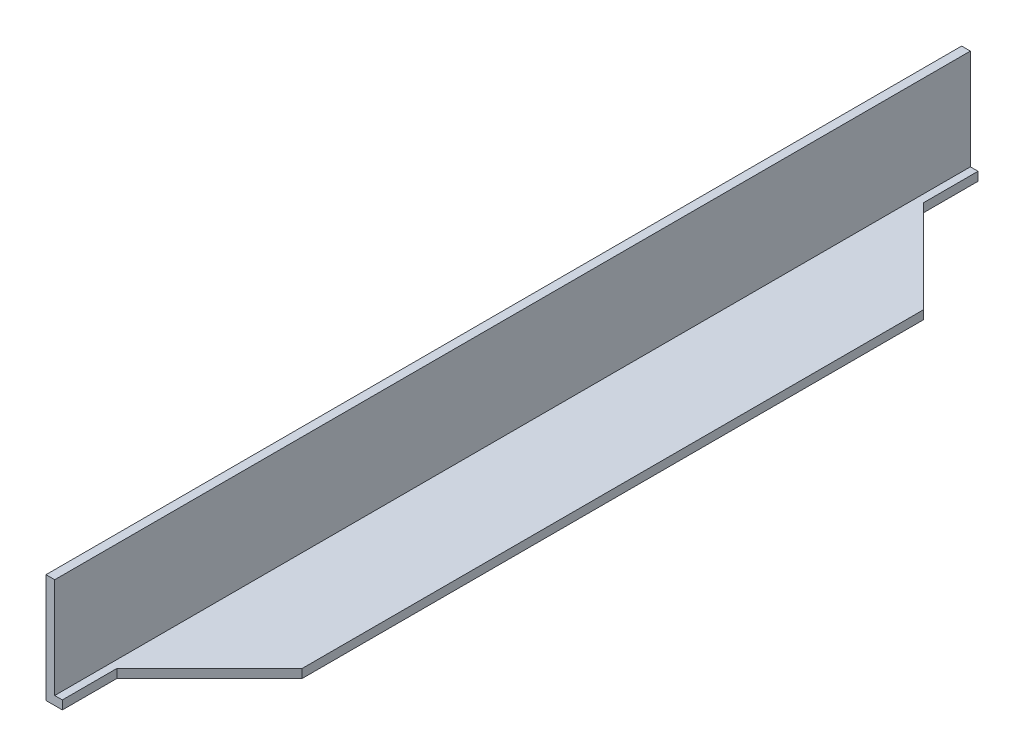
from build123d import *

# Parameters (mm, degrees)
SKETCH_1_W          = 100
SKETCH_1_H          = 100
EXTRUDE_1_DEPTH     = 840
SKETCH_2_W          = 92
SKETCH_2_H          = 92
CUT_EXTRUDE_1_DEPTH = 852.821577562
CUT_EXTRUDE_3_DEPTH = 851.919502656


with BuildPart() as part:
    # 草图1 → 凸台-拉伸1 (new body)
    with BuildSketch(Plane.XY):
        with Locations((50, 50)):
            Rectangle(SKETCH_1_W, SKETCH_1_H)
    extrude(amount=EXTRUDE_1_DEPTH)

    # 草图2 → 切除-拉伸1 (cut, through all)
    with BuildSketch(Plane.XY.offset(840)):
        with Locations((54, 54)):
            Rectangle(SKETCH_2_W, SKETCH_2_H)
    extrude(amount=-CUT_EXTRUDE_1_DEPTH, mode=Mode.SUBTRACT)

    # 草图4 → 切除-拉伸3 (cut, through all)
    with BuildSketch(Plane(origin=(0, 8, 0), x_dir=(1, 0, 0), z_dir=(0, 1, 0))):
        Polygon((15, 0), (15, -50), (100, -135), (100, 0), align=None)
        Polygon((15, -840), (15, -790), (100, -705), (100, -840), align=None)
    extrude(amount=-CUT_EXTRUDE_3_DEPTH, mode=Mode.SUBTRACT)


solid = part.part
